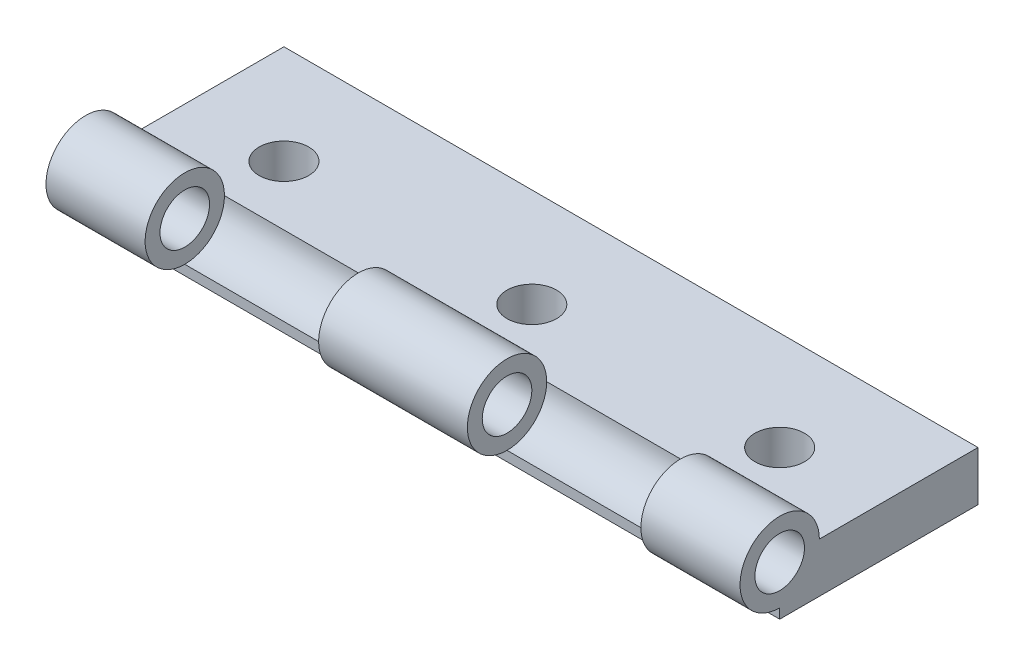
from build123d import *

# Parameters (mm, degrees)
SKETCH2_W           = 88.9
SKETCH2_H           = 25.4
SKETCH2_R           = 3.175
BOSS_EXTRUDE1_DEPTH = 6.35
SKETCH3_R           = 5.08
CUT_EXTRUDE1_DEPTH  = 93.675198948
SKETCH4_R           = 5.08
SKETCH4_R_2         = 3.175
BOSS_EXTRUDE2_DEPTH = 12.7
SKETCH5_R           = 5.08
SKETCH5_R_2         = 3.175
BOSS_EXTRUDE3_DEPTH = 9.525


with BuildPart() as part:
    # Sketch2 → Boss-Extrude1 (new body)
    with BuildSketch(Plane(origin=(0, 0, 0), x_dir=(1, 0, 0), z_dir=(0, 1, 0))):
        with Locations((0, 12.7)):
            Rectangle(SKETCH2_W, SKETCH2_H)
        with Locations(Location((-31.75, 12.7, 0), (0, 0, 270))):
            Circle(SKETCH2_R, mode=Mode.SUBTRACT)
        with Locations(Location((0, 12.7, 0), (0, 0, 270))):
            Circle(SKETCH2_R, mode=Mode.SUBTRACT)
        with Locations(Location((31.75, 12.7, 0), (0, 0, 270))):
            Circle(SKETCH2_R, mode=Mode.SUBTRACT)
    extrude(amount=BOSS_EXTRUDE1_DEPTH)

    # Sketch3 → Cut-Extrude1 (cut, through all)
    with BuildSketch(Plane.ZY.offset(44.45)):
        with Locations((0, 6.35)):
            Circle(SKETCH3_R)
    extrude(amount=-CUT_EXTRUDE1_DEPTH, mode=Mode.SUBTRACT)

    # Sketch4 → Boss-Extrude2 (add)
    with BuildSketch(Plane.ZY.offset(44.45)):
        with Locations((0, 6.35)):
            Circle(SKETCH4_R)
        with Locations((0, 6.35)):
            Circle(SKETCH4_R_2, mode=Mode.SUBTRACT)
    boss_extrude2 = extrude(amount=-BOSS_EXTRUDE2_DEPTH)

    # Mirror1: Boss-Extrude2 across plane
    add(boss_extrude2.mirror(Plane(origin=(0, 0, 0), x_dir=(0, 0, 1), z_dir=(1, 0, 0))))

    # Sketch5 → Boss-Extrude3 (add, symmetric)
    with BuildSketch(Plane(origin=(0, 0, 0), x_dir=(0, 0, -1), z_dir=(1, 0, 0))):
        with Locations((0, 6.35)):
            Circle(SKETCH5_R)
        with Locations(Location((0, 6.35, 0), (0, 0, 180))):
            Circle(SKETCH5_R_2, mode=Mode.SUBTRACT)
    extrude(amount=BOSS_EXTRUDE3_DEPTH, both=True)


solid = part.part
